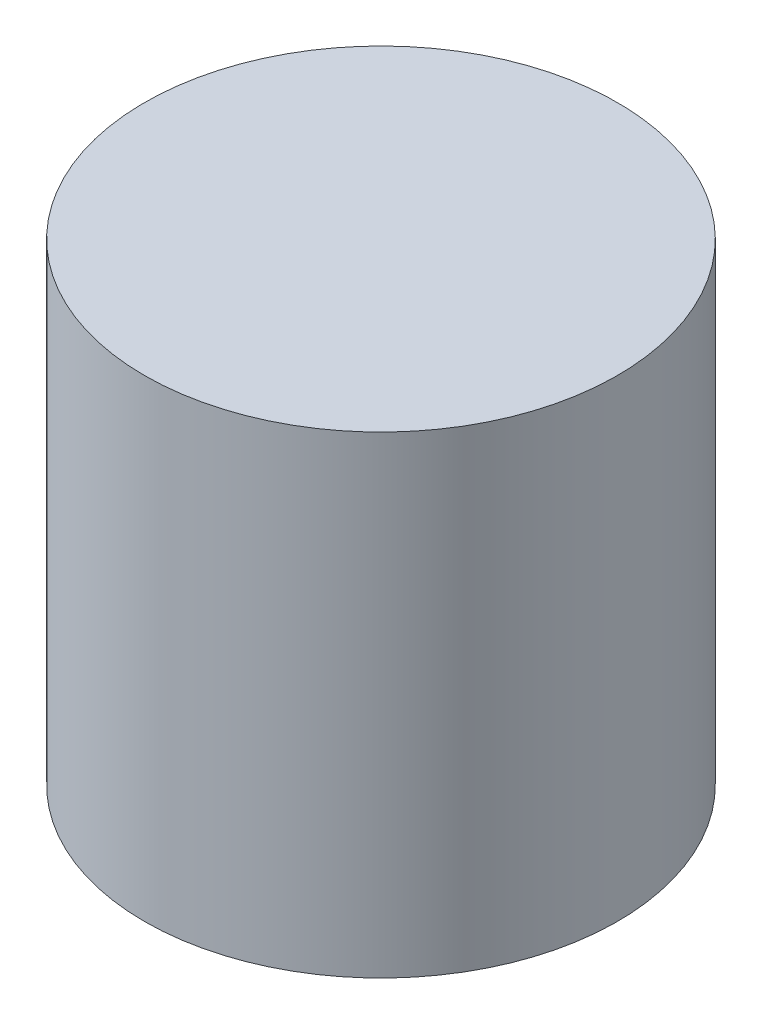
from build123d import *

# Parameters (mm, degrees)
SKETCH1_R           = 3
BOSS_EXTRUDE1_DEPTH = 3


with BuildPart() as part:
    # Sketch1 → Boss-Extrude1 (new, symmetric)
    with BuildSketch(Plane(origin=(0, 0, 0), x_dir=(1, 0, 0), z_dir=(0, 1, 0))):
        with Locations(Location((0, 0, 0), (0, 0, 270))):
            Circle(SKETCH1_R)
    extrude(amount=BOSS_EXTRUDE1_DEPTH, both=True)


solid = part.part
